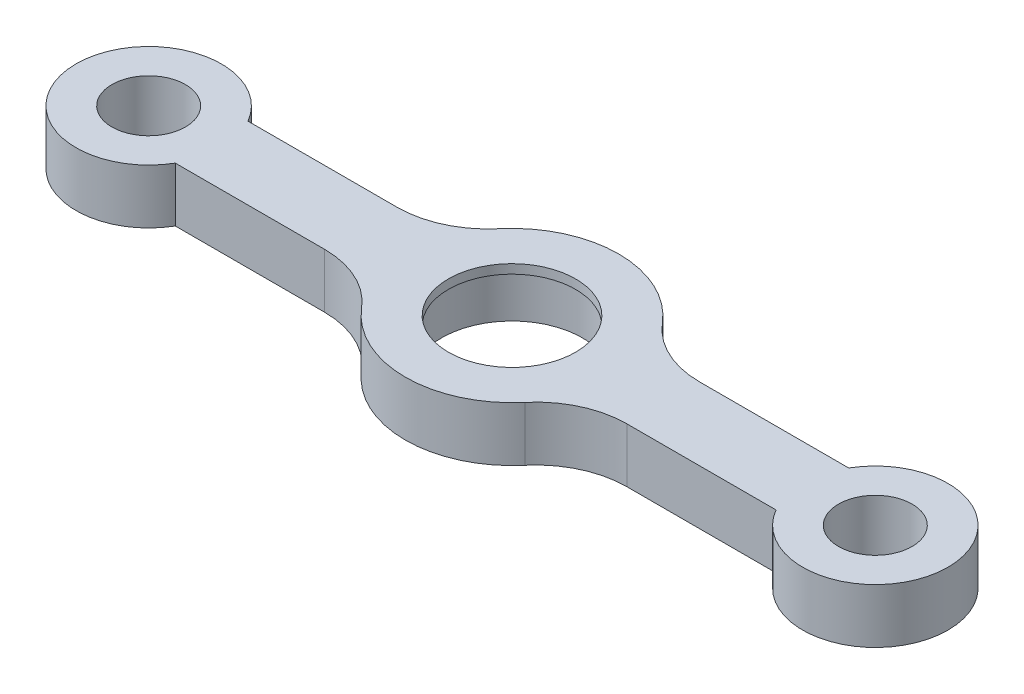
from build123d import *

# Parameters (mm, degrees)
ESBO_O1_R                = 4.05
ESBO_O1_R_2              = 7.75
RESSALTO_EXTRUS_O1_DEPTH = 6
RESSALTO_EXTRUS_O2_START = -1
ESBO_O2_R                = 7.75
ESBO_O2_R_2              = 7
RESSALTO_EXTRUS_O2_DEPTH = 1


with BuildPart() as part:
    # Esboço1 → Ressalto-extrusão1 (new body)
    with BuildSketch(Plane(origin=(0, 0, 0), x_dir=(1, 0, 0), z_dir=(0, 1, 0))):
        with BuildLine():
            Line((-33.07179677, 4), (-16.645194502, 4))
            ThreePointArc((-16.645194502, 4), (-12.424283231, 4.934465926), (-8.992231512, 7.563218391))
            ThreePointArc((-8.992231512, 7.563218391), (0, 11.75), (8.992231512, 7.563218391))
            ThreePointArc((8.992231512, 7.563218391), (12.424283231, 4.934465926), (16.645194502, 4))
            Line((16.645194502, 4), (33.07179677, 4))
            ThreePointArc((33.07179677, 4), (48, 0), (33.07179677, -4))
            Line((33.07179677, -4), (16.645194502, -4))
            ThreePointArc((16.645194502, -4), (12.424283231, -4.934465926), (8.992231512, -7.563218391))
            ThreePointArc((8.992231512, -7.563218391), (0, -11.75), (-8.992231512, -7.563218391))
            ThreePointArc((-8.992231512, -7.563218391), (-12.424283231, -4.934465926), (-16.645194502, -4))
            Line((-16.645194502, -4), (-33.07179677, -4))
            ThreePointArc((-33.07179677, -4), (-48, 0), (-33.07179677, 4))
        make_face()
        with Locations(Location((40, 0, 0), (0, 0, 270))):
            Circle(ESBO_O1_R, mode=Mode.SUBTRACT)
        with Locations(Location((-40, 0, 0), (0, 0, 270))):
            Circle(ESBO_O1_R, mode=Mode.SUBTRACT)
        with Locations(Location((0, 0, 0), (0, 0, 270))):
            Circle(ESBO_O1_R_2, mode=Mode.SUBTRACT)
    extrude(amount=RESSALTO_EXTRUS_O1_DEPTH)

    # Esboço2 → Ressalto-extrusão2 (add)
    with BuildSketch(Plane(origin=(0, 6, 0), x_dir=(1, 0, 0), z_dir=(0, 1, 0)).offset(RESSALTO_EXTRUS_O2_START)):
        with Locations(Location((0, 0, 0), (0, 0, 270))):
            Circle(ESBO_O2_R)
        with Locations(Location((0, 0, 0), (0, 0, 270))):
            Circle(ESBO_O2_R_2, mode=Mode.SUBTRACT)
    extrude(amount=RESSALTO_EXTRUS_O2_DEPTH)


solid = part.part
